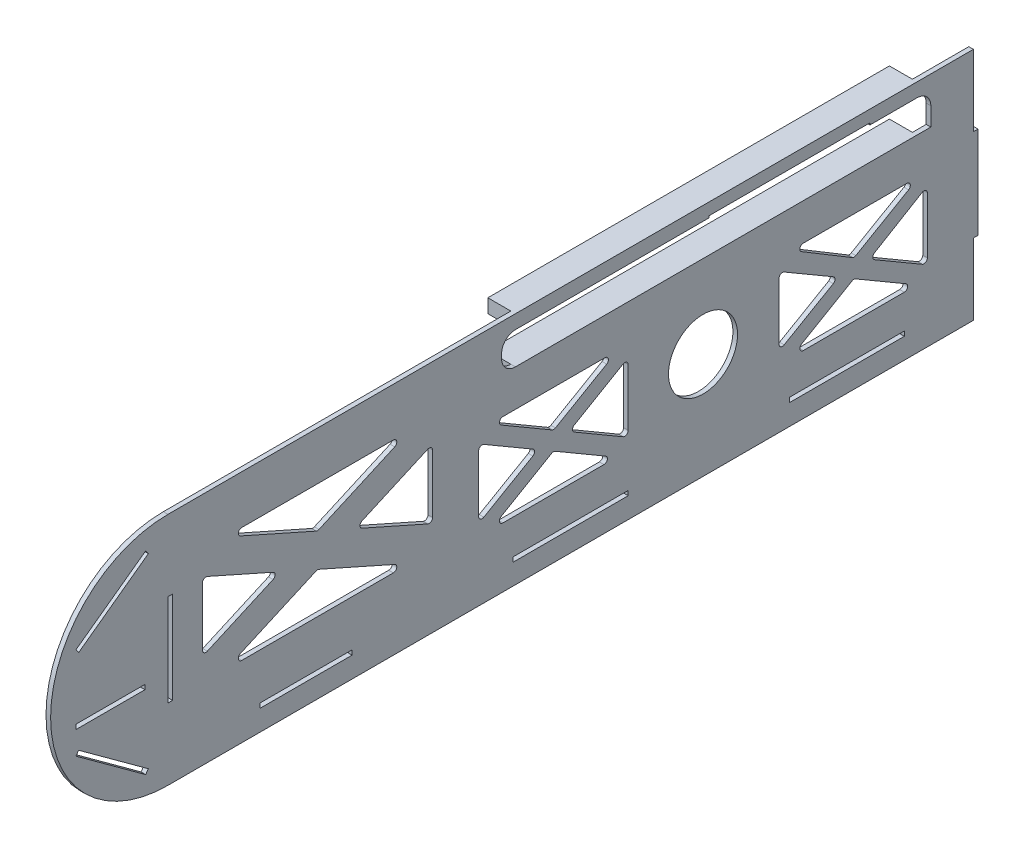
from build123d import *

# Parameters (mm, degrees)
SKETCH_1_W      = 2
SKETCH_1_H      = 40
SKETCH_1_W_2    = 40
SKETCH_1_H_2    = 2
SKETCH_1_W_3    = 50
SKETCH_1_R      = 15
SKETCH_1_W_4    = 30
EXTRUDE_3_DEPTH = 2
EXTRUDE_4_DEPTH = 10


with BuildPart() as part:
    # 草图1 → 凸台-拉伸3 (new body)
    with BuildSketch(Plane(origin=(0, 0, 0), x_dir=(0, 0, -1), z_dir=(1, 0, 0))):
        with BuildLine():
            Line((350, 51), (0, 51))
            ThreePointArc((0, 51), (-51, 0), (0, -51))
            Line((0, -51), (350, -51))
            Line((350, -51), (350, -20))
            Line((350, -20), (352, -20))
            Line((352, -20), (352, 20))
            Line((352, 20), (350, 20))
            Line((350, 20), (350, 51))
        make_face()
        with BuildLine():
            ThreePointArc((145, 39), (146.757359313, 43.242640687), (151, 45))
            Line((151, 45), (235, 45))
            Line((235, 45), (235, 45.8))
            Line((235, 45.8), (305, 45.8))
            Line((305, 45.8), (305, 45))
            Line((305, 45), (325.5, 45))
            ThreePointArc((325.5, 45), (329.742640687, 43.242640687), (331.5, 39))
            Line((331.5, 39), (331.5, 31))
            Line((331.5, 31), (151, 31))
            ThreePointArc((151, 31), (146.757359313, 32.757359313), (145, 37))
            Line((145, 37), (145, 39))
        make_face(mode=Mode.SUBTRACT)
        with Locations((1, 0)):
            Rectangle(SKETCH_1_W, SKETCH_1_H, mode=Mode.SUBTRACT)
        with Locations((60, -41)):
            Rectangle(SKETCH_1_W_2, SKETCH_1_H_2, mode=Mode.SUBTRACT)
        with BuildLine():
            Line((97.931678324, -20), (32.068321676, -20))
            ThreePointArc((32.068321676, -20), (30.600998265, -18.811387231), (31.459113977, -17.129282677))
            Line((31.459113977, -17.129282677), (64.390792301, -2.4929812))
            ThreePointArc((64.390792301, -2.4929812), (65, -2.363698523), (65.609207699, -2.4929812))
            Line((65.609207699, -2.4929812), (98.540886023, -17.129282677))
            ThreePointArc((98.540886023, -17.129282677), (99.399001735, -18.811387231), (97.931678324, -20))
        make_face(mode=Mode.SUBTRACT)
        with BuildLine():
            Line((135, -17.39868764), (135, 7.388444501))
            ThreePointArc((135, 7.388444501), (135.75290891, 8.68915773), (137.255806538, 8.684112853))
            Line((137.255806538, 8.684112853), (158.585016393, -3.757926229))
            ThreePointArc((158.585016393, -3.757926229), (159.329207689, -5.056143052), (158.580609404, -6.35182365))
            Line((158.580609404, -6.35182365), (137.25139955, -18.69691671))
            ThreePointArc((137.25139955, -18.69691671), (135.750700102, -18.698129698), (135, -17.39868764))
        make_face(mode=Mode.SUBTRACT)
        with Locations((175, -41)):
            Rectangle(SKETCH_1_W_3, SKETCH_1_H_2, mode=Mode.SUBTRACT)
        with Locations((295, -41)):
            Rectangle(SKETCH_1_W_3, SKETCH_1_H_2, mode=Mode.SUBTRACT)
        with BuildLine():
            Line((189.451619145, -25), (145.548380855, -25))
            ThreePointArc((145.548380855, -25), (144.100364535, -23.891469969), (144.792574317, -22.204331649))
            Line((144.792574317, -22.204331649), (166.744193462, -9.399220481))
            ThreePointArc((166.744193462, -9.399220481), (167.5, -9.194888832), (168.255806538, -9.399220481))
            Line((168.255806538, -9.399220481), (190.207425683, -22.204331649))
            ThreePointArc((190.207425683, -22.204331649), (190.899635465, -23.891469969), (189.451619145, -25))
        make_face(mode=Mode.SUBTRACT)
        with BuildLine():
            ThreePointArc((197.744193462, 8.684112853), (199.24709109, 8.68915773), (200, 7.388444501))
            Line((200, 7.388444501), (200, -17.388444501))
            ThreePointArc((200, -17.388444501), (199.24709109, -18.68915773), (197.744193462, -18.684112853))
            Line((197.744193462, -18.684112853), (176.506860031, -6.295668351))
            ThreePointArc((176.506860031, -6.295668351), (175.762666569, -5), (176.506860031, -3.704331649))
            Line((176.506860031, -3.704331649), (197.744193462, 8.684112853))
        make_face(mode=Mode.SUBTRACT)
        with Locations((232.5, -5)):
            Circle(SKETCH_1_R, mode=Mode.SUBTRACT)
        with BuildLine():
            Line((319.974166797, -25.394327939), (276.070928507, -25.394327939))
            ThreePointArc((276.070928507, -25.394327939), (274.622912187, -24.285797907), (275.315121969, -22.598659587))
            Line((275.315121969, -22.598659587), (297.266741114, -9.793548419))
            ThreePointArc((297.266741114, -9.793548419), (298.022547652, -9.589216771), (298.778354191, -9.793548419))
            Line((298.778354191, -9.793548419), (320.729973336, -22.598659587))
            ThreePointArc((320.729973336, -22.598659587), (321.422183118, -24.285797907), (319.974166797, -25.394327939))
        make_face(mode=Mode.SUBTRACT)
        with BuildLine():
            Line((265.522547652, -17.793015579), (265.522547652, 6.994116563))
            ThreePointArc((265.522547652, 6.994116563), (266.275456563, 8.294829792), (267.778354191, 8.289784914))
            Line((267.778354191, 8.289784914), (289.107564045, -4.152254168))
            ThreePointArc((289.107564045, -4.152254168), (289.851755342, -5.45047099), (289.103157056, -6.746151588))
            Line((289.103157056, -6.746151588), (267.773947202, -19.091244648))
            ThreePointArc((267.773947202, -19.091244648), (266.273247754, -19.092457637), (265.522547652, -17.793015579))
        make_face(mode=Mode.SUBTRACT)
        with BuildLine():
            ThreePointArc((327.730104505, 8.28146303), (329.239985391, 8.298885363), (330, 6.994116563))
            Line((330, 6.994116563), (330, -17.477952976))
            ThreePointArc((330, -17.477952976), (329.24709109, -18.778666205), (327.744193462, -18.773621327))
            Line((327.744193462, -18.773621327), (307.029407683, -6.68999629))
            ThreePointArc((307.029407683, -6.68999629), (306.285236534, -5.40250951), (307.015318726, -4.106981472))
            Line((307.015318726, -4.106981472), (327.730104505, 8.28146303))
        make_face(mode=Mode.SUBTRACT)
        with BuildLine():
            Line((15, -7.691857033), (15, 17.691857033))
            ThreePointArc((15, 17.691857033), (15.682629689, 18.94959539), (17.109207699, 19.062574356))
            Line((17.109207699, 19.062574356), (45.665886023, 6.370717323))
            ThreePointArc((45.665886023, 6.370717323), (46.556678324, 5), (45.665886023, 3.629282677))
            Line((45.665886023, 3.629282677), (17.109207699, -9.062574356))
            ThreePointArc((17.109207699, -9.062574356), (15.682629689, -8.94959539), (15, -7.691857033))
        make_face(mode=Mode.SUBTRACT)
        with BuildLine():
            Line((112.890792301, -9.062574356), (84.334113977, 3.629282677))
            ThreePointArc((84.334113977, 3.629282677), (83.443321676, 5), (84.334113977, 6.370717323))
            Line((84.334113977, 6.370717323), (112.890792301, 19.062574356))
            ThreePointArc((112.890792301, 19.062574356), (114.317370311, 18.94959539), (115, 17.691857033))
            Line((115, 17.691857033), (115, -7.691857033))
            ThreePointArc((115, -7.691857033), (114.317370311, -8.94959539), (112.890792301, -9.062574356))
        make_face(mode=Mode.SUBTRACT)
        with BuildLine():
            ThreePointArc((31.459113977, 27.129282677), (30.600998265, 28.811387231), (32.068321676, 30))
            Line((32.068321676, 30), (97.931678324, 30))
            ThreePointArc((97.931678324, 30), (99.399001735, 28.811387231), (98.540886023, 27.129282677))
            Line((98.540886023, 27.129282677), (65.609207699, 12.4929812))
            ThreePointArc((65.609207699, 12.4929812), (65, 12.363698523), (64.390792301, 12.4929812))
            Line((64.390792301, 12.4929812), (31.459113977, 27.129282677))
        make_face(mode=Mode.SUBTRACT)
        with BuildLine():
            ThreePointArc((144.792574317, 12.204331649), (144.100364535, 13.891469969), (145.548380855, 15))
            Line((145.548380855, 15), (189.885145799, 15))
            ThreePointArc((189.885145799, 15), (191.333825129, 13.889009252), (190.636545348, 12.20177093))
            Line((190.636545348, 12.20177093), (168.381459159, -0.679208343))
            ThreePointArc((168.381459159, -0.679208343), (167.627511138, -0.880977109), (166.874253072, -0.676647625))
            Line((166.874253072, -0.676647625), (144.792574317, 12.204331649))
        make_face(mode=Mode.SUBTRACT)
        with BuildLine():
            ThreePointArc((275.298059327, 12.21443661), (274.625531488, 13.901032988), (276.070928507, 15))
            Line((276.070928507, 15), (321.088992758, 15))
            ThreePointArc((321.088992758, 15), (322.537672089, 13.889009252), (321.840392308, 12.20177093))
            Line((321.840392308, 12.20177093), (298.904006812, -1.073536282))
            ThreePointArc((298.904006812, -1.073536282), (298.140143671, -1.275255431), (297.379738082, -1.060870603))
            Line((297.379738082, -1.060870603), (275.298059327, 12.21443661))
        make_face(mode=Mode.SUBTRACT)
        Polygon((-40, 20), (-9.698170842, 42.091834457), (-8.519939671, 40.475736902), (-38.821768829, 18.383902445), align=None, mode=Mode.SUBTRACT)
        with Locations((-25, -9)):
            Rectangle(SKETCH_1_W_4, SKETCH_1_H_2, mode=Mode.SUBTRACT)
        Polygon((-40, -20), (-38.821768829, -18.383902445), (-8.519939671, -40.475736902), (-9.698170842, -42.091834457), align=None, mode=Mode.SUBTRACT)
    extrude(amount=EXTRUDE_3_DEPTH)

    # 草图2 → 凸台-拉伸4 (add)
    with BuildSketch(Plane(origin=(0, 0, 0), x_dir=(0, 0, -1), z_dir=(1, 0, 0))):
        Polygon((151, 51), (151, 45), (235, 45), (235, 45.8), (305, 45.8), (305, 45), (325.5, 45), (325.5, 51), align=None)
        Polygon((325.5, 31), (151, 31), (151, 24), (325.5, 23.560383637), align=None)
    extrude(amount=-EXTRUDE_4_DEPTH)


solid = part.part
